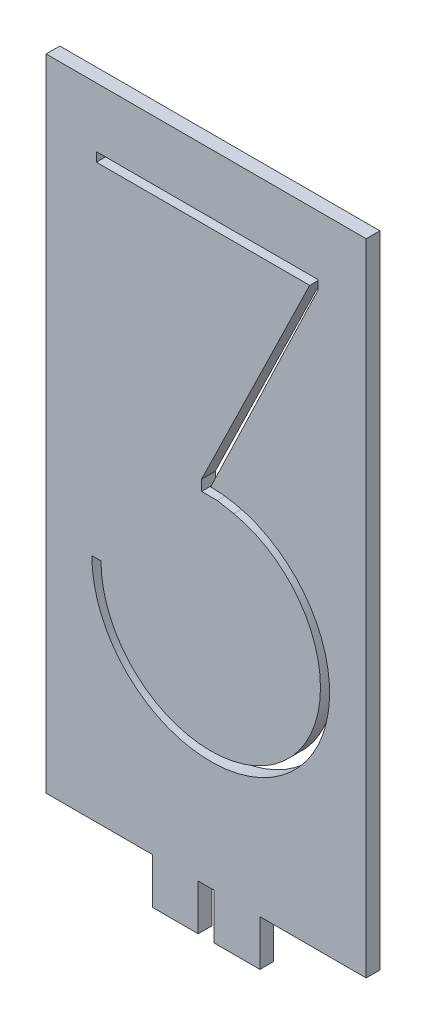
from build123d import *

# Parameters (mm, degrees)
SKIZZE1_W                       = 35
SKIZZE1_H                       = 75
AUFSATZ_LINEAR_AUSTRAGEN1_DEPTH = 1.5
SKIZZE2_W                       = 11.63
SKIZZE2_H                       = 5
SKIZZE2_W_2                     = 11.62
SKIZZE2_W_3                     = 1.75
SCHNITT_LINEAR_AUSTRAGEN1_DEPTH = 1.5
SCHNITT_LINEAR_AUSTRAGEN4_DEPTH = 20


with BuildPart() as part:
    # Skizze1 → Aufsatz-Linear austragen1 (new body)
    with BuildSketch(Plane.XY):
        with Locations((17.5, 37.5)):
            Rectangle(SKIZZE1_W, SKIZZE1_H)
    extrude(amount=AUFSATZ_LINEAR_AUSTRAGEN1_DEPTH)

    # Skizze2 → Schnitt-Linear austragen1 (cut)
    with BuildSketch(Plane.XY.offset(1.5)):
        with Locations((5.815, 2.5)):
            Rectangle(SKIZZE2_W, SKIZZE2_H)
        with Locations((29.19, 2.5)):
            Rectangle(SKIZZE2_W_2, SKIZZE2_H)
        with Locations((17.505, 2.5)):
            Rectangle(SKIZZE2_W_3, SKIZZE2_H)
    extrude(amount=-SCHNITT_LINEAR_AUSTRAGEN1_DEPTH, mode=Mode.SUBTRACT)

    # Skizze9 → Schnitt-Linear austragen4 (cut)
    with BuildSketch(Plane.XY.offset(1.5)):
        with BuildLine():
            Line((18, 43), (29.734930419, 67.5))
            Line((29.734930419, 67.5), (29.734930419, 68.5))
            Line((29.734930419, 68.5), (5.5, 68.5))
            Line((5.5, 68.5), (5.5, 67.5))
            Line((5.5, 67.5), (28.826499189, 67.5))
            Line((28.826499189, 67.5), (17, 43.230685214))
            Line((17, 43.230685214), (17, 42.069041261))
            Line((17, 42.069041261), (18.731597041, 42.069041261))
            Line((18.731597041, 42.069041261), (19.547222411, 41.915420677))
            Line((19.547222411, 41.915420677), (20.52804755, 41.730685214))
            ThreePointArc((20.52804755, 41.730685214), (25.538681231, 20.663604266), (6, 30))
            Line((6, 30), (5, 30))
            ThreePointArc((5, 30), (27.192388155, 20.807611845), (18, 43))
        make_face()
    extrude(amount=-SCHNITT_LINEAR_AUSTRAGEN4_DEPTH, mode=Mode.SUBTRACT)


solid = part.part
